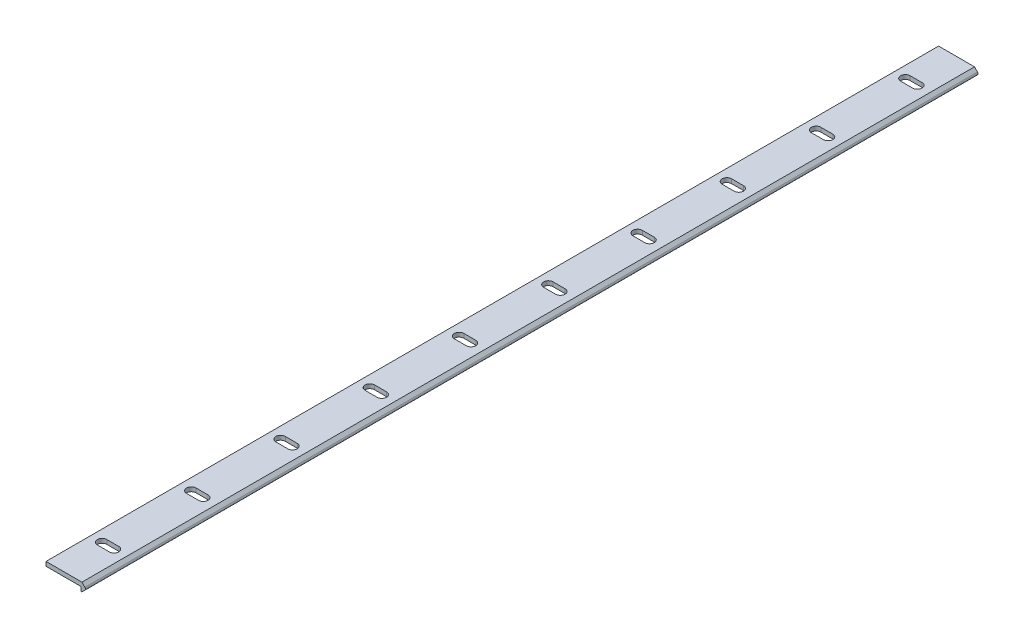
from build123d import *

# Parameters (mm, degrees)
BOSS_EXTRUDE1_DEPTH = 500
CUT_EXTRUDE1_DEPTH  = 2.375
LPATTERN1_COUNT     = 10
LPATTERN1_PITCH     = 50
FILLET1_R           = 1


with BuildPart() as part:
    # Sketch1 → Boss-Extrude1 (new body)
    with BuildSketch(Plane.XY):
        Polygon((19.5291, 2.375), (0, 2.375), (0, 4.75), (19.5291, 4.75), (20.122, 4.75), (22.497, 2.375), (20.122, 0), (19.5291, 0), align=None)
    extrude(amount=BOSS_EXTRUDE1_DEPTH)

    # Sketch2 → Cut-Extrude1 (cut)
    with BuildSketch(Plane(origin=(0, 4.75, 0), x_dir=(1, 0, 0), z_dir=(0, 1, 0))):
        with BuildLine():
            Line((6.4087, -22.35), (13.1087, -22.35))
            ThreePointArc((13.1087, -22.35), (15.7587, -25), (13.1087, -27.65))
            Line((13.1087, -27.65), (6.4087, -27.65))
            ThreePointArc((6.4087, -27.65), (3.7587, -25), (6.4087, -22.35))
        make_face()
    cut_extrude1 = extrude(amount=-CUT_EXTRUDE1_DEPTH, mode=Mode.SUBTRACT)

    # LPattern1: Cut-Extrude1 ×10
    with Locations(*[(0, 0, i * LPATTERN1_PITCH) for i in range(1, LPATTERN1_COUNT)]):
        add(cut_extrude1, mode=Mode.SUBTRACT)

    # Fillet1
    fillet1_edges = [part.edges().sort_by_distance(p)[0] for p in [
        (22.497, 2.375, 250),
    ]]
    fillet(fillet1_edges, radius=FILLET1_R)


solid = part.part
